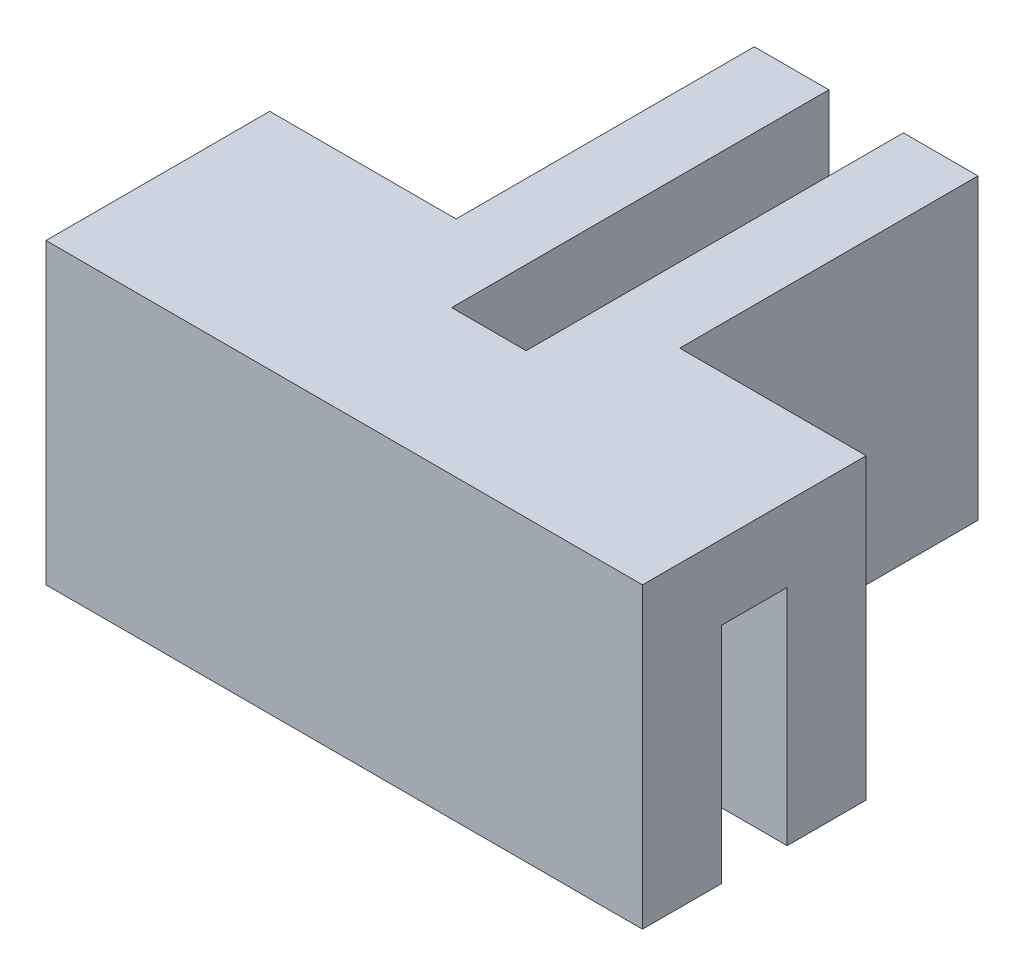
from build123d import *

# Parameters (mm, degrees)
BOSS_EXTRUDE1_DEPTH = 12.7
SKETCH3_W           = 25.4
SKETCH3_H           = 2.794
CUT_EXTRUDE1_DEPTH  = 9.525


with BuildPart() as part:
    # Sketch2 → Boss-Extrude1 (new body)
    with BuildSketch(Plane(origin=(0, 0, 0), x_dir=(1, 0, 0), z_dir=(0, 1, 0))):
        Polygon((-4.7625, 0), (-12.7, 0), (-12.7, -9.525), (12.7, -9.525), (12.7, 0), (4.7625, 0), (4.7625, 12.7), (1.5875, 12.7), (1.5875, -3.3655), (-1.5875, -3.3655), (-1.5875, 12.7), (-4.7625, 12.7), align=None)
    extrude(amount=BOSS_EXTRUDE1_DEPTH)

    # Sketch3 → Cut-Extrude1 (cut)
    with BuildSketch(Plane.XZ):
        with Locations((0, 4.7625)):
            Rectangle(SKETCH3_W, SKETCH3_H)
    extrude(amount=-CUT_EXTRUDE1_DEPTH, mode=Mode.SUBTRACT)


solid = part.part
